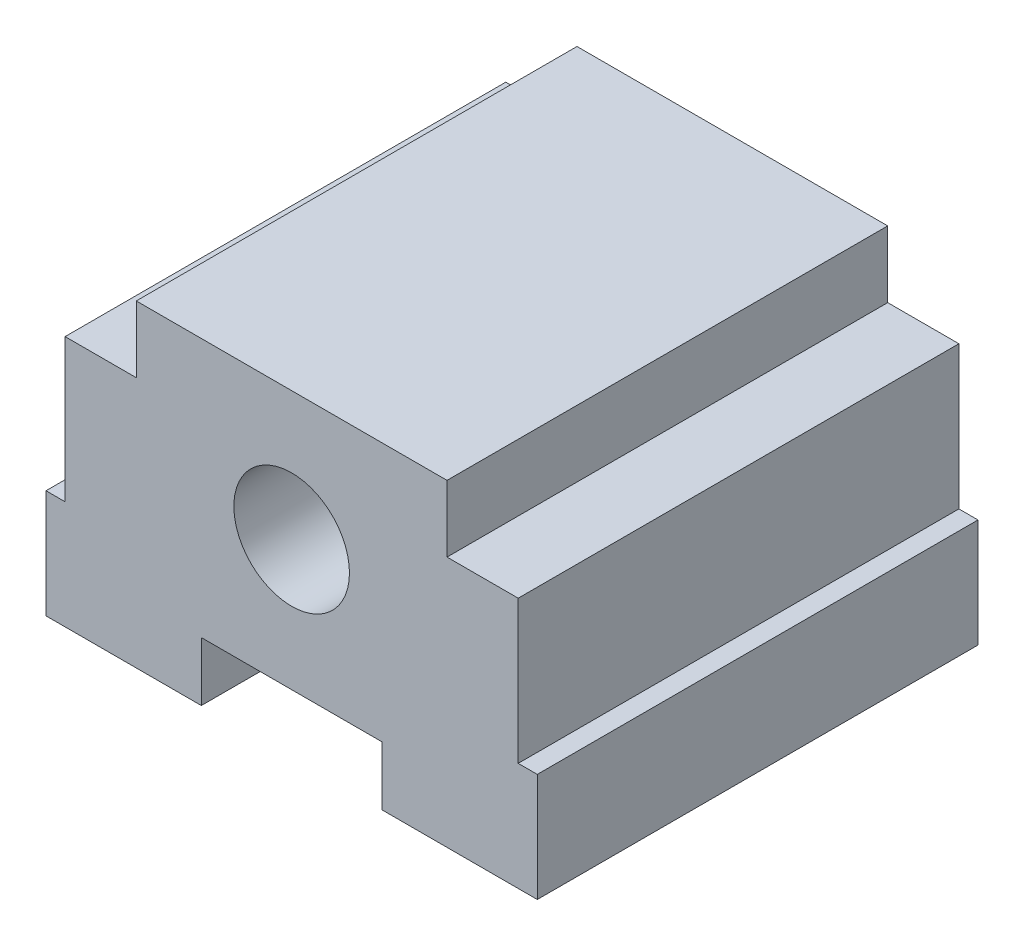
from build123d import *

# Parameters (mm, degrees)
BOSS_EXTRUDE1_DEPTH = 30.5
SKETCH2_R           = 4
CUT_EXTRUDE1_DEPTH  = 30.5


with BuildPart() as part:
    # Sketch1 → Boss-Extrude1 (new body)
    with BuildSketch(Plane.XY):
        Polygon((6.25, 0), (-6.25, 0), (-6.25, -4.075971731), (-17, -4.075971731), (-17, 3.424028269), (-15.67844523, 3.424028269), (-15.67844523, 13.324028269), (-10.752650177, 13.324028269), (-10.752650177, 17.924028269), (10.752650177, 17.924028269), (10.752650177, 13.324028269), (15.67844523, 13.324028269), (15.67844523, 3.424028269), (17, 3.424028269), (17, -4.075971731), (6.25, -4.075971731), align=None)
    extrude(amount=BOSS_EXTRUDE1_DEPTH)

    # Sketch2 → Cut-Extrude1 (cut)
    with BuildSketch(Plane.XY.offset(30.5)):
        with Locations((0, 8.998418613)):
            Circle(SKETCH2_R)
    extrude(amount=-CUT_EXTRUDE1_DEPTH, mode=Mode.SUBTRACT)


solid = part.part
